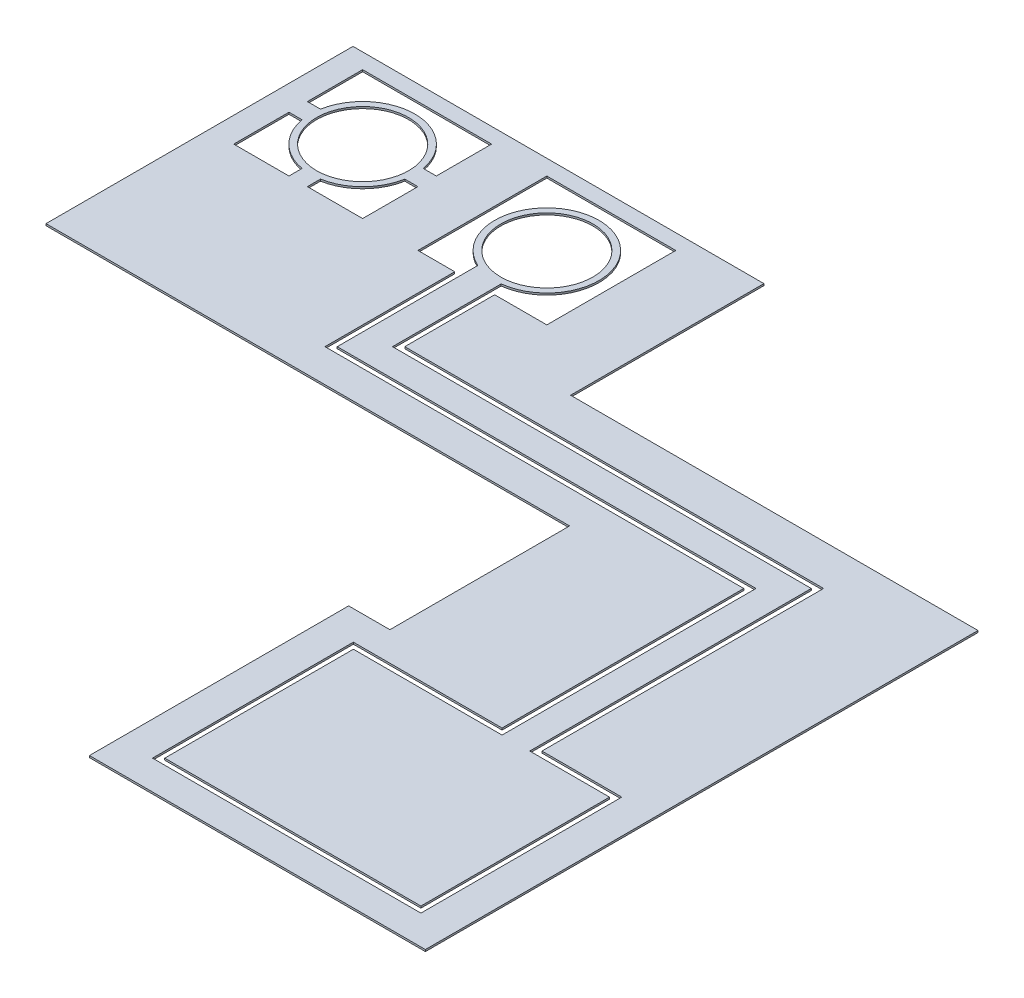
from build123d import *

# Parameters (mm, degrees)
SKETCH1_W               = 2.1
SKETCH1_H               = 2.1
BOSS_EXTRUDE1_DEPTH     = 0.03
CUT_EXTRUDE1_DEPTH      = 16.124307753
CUT_EXTRUDE1_DEPTH_BACK = 16.124307753
BOSS_EXTRUDE2_DEPTH     = 0.03
BOSS_EXTRUDE3_DEPTH     = 0.03
CUT_EXTRUDE2_DEPTH      = 16.124307753
CUT_EXTRUDE2_DEPTH_BACK = 16.124307753
SKETCH5_R               = 0.75


with BuildPart() as part:
    # Sketch1 → Boss-Extrude1 (new body)
    with BuildSketch(Plane(origin=(0, 0, 0), x_dir=(1, 0, 0), z_dir=(0, 1, 0))):
        Polygon((0, 0), (0, 5), (6.692, 5), (6.692, 1.851), (13.328, 1.851), (13.328, -7.149), (7.856, -7.149), (7.856, -2.927), (8.528, -2.927), (8.528, 0), align=None)
        with Locations((1.457, 3.7)):
            Rectangle(SKETCH1_W, SKETCH1_H, mode=Mode.SUBTRACT)
        with Locations((4.457, 3.7)):
            Rectangle(SKETCH1_W, SKETCH1_H, mode=Mode.SUBTRACT)
    extrude(amount=BOSS_EXTRUDE1_DEPTH)

    # Sketch2 → Cut-Extrude1 (cut, two sides: drawn at the far end of the back side and taken through both)
    with BuildSketch(Plane(origin=(0, 0.03, 0), x_dir=(1, 0, 0), z_dir=(0, 1, 0)).offset(-CUT_EXTRUDE1_DEPTH_BACK)):
        Polygon((4.107, 2.65), (4.107, 0.636), (10.928, 0.636), (10.928, -3.5), (8.506, -3.5), (8.506, -6.572), (12.678, -6.572), (12.678, -3.5), (11.378, -3.5), (11.378, 1.086), (4.557, 1.086), (4.557, 2.65), (4.657, 2.65), (4.657, 1.186), (11.478, 1.186), (11.478, -3.4), (12.778, -3.4), (12.778, -6.672), (8.406, -6.672), (8.406, -3.4), (10.828, -3.4), (10.828, 0.536), (4.007, 0.536), (4.007, 2.65), align=None)
    extrude(amount=CUT_EXTRUDE1_DEPTH + CUT_EXTRUDE1_DEPTH_BACK, mode=Mode.SUBTRACT)


with BuildPart() as cut_extrude1_piece_1:
    # of the separate pieces the step leaves, piece 1, a body of its own (cut_extrude1_pieces)
    add(part.part.solids().sort_by_distance((0, 0, 0))[0])

    # Sketch4 → Boss-Extrude3 (add)
    with BuildSketch(Plane(origin=(0, 0.03, 0), x_dir=(1, 0, 0), z_dir=(0, 1, 0))):
        with BuildLine():
            Line((1.307, 2.65), (1.607, 2.65))
            Line((1.607, 2.65), (1.607, 2.863339973))
            ThreePointArc((1.607, 2.863339973), (2.058040764, 3.098959236), (2.293660027, 3.55))
            Line((2.293660027, 3.55), (2.507, 3.55))
            Line((2.507, 3.55), (2.507, 3.85))
            Line((2.507, 3.85), (2.293660027, 3.85))
            ThreePointArc((2.293660027, 3.85), (1.457, 4.55), (0.620339973, 3.85))
            Line((0.620339973, 3.85), (0.407, 3.85))
            Line((0.407, 3.85), (0.407, 3.55))
            Line((0.407, 3.55), (0.620339973, 3.55))
            ThreePointArc((0.620339973, 3.55), (0.855959236, 3.098959236), (1.307, 2.863339973))
            Line((1.307, 2.863339973), (1.307, 2.65))
        make_face()
    extrude(amount=-BOSS_EXTRUDE3_DEPTH)


with BuildPart() as cut_extrude1_piece_2:
    # of the separate pieces the step leaves, piece 2, a body of its own (cut_extrude1_pieces)
    add(part.part.solids().sort_by_distance((4.107, 0, -2.65))[0])

    # Sketch3 → Boss-Extrude2 (add)
    with BuildSketch(Plane(origin=(0, 0.03, 0), x_dir=(1, 0, 0), z_dir=(0, 1, 0))):
        with BuildLine():
            Line((4.107, 2.65), (4.557, 2.65))
            Line((4.557, 2.65), (4.557, 2.855902849))
            ThreePointArc((4.557, 2.855902849), (4.58674043, 4.54004013), (4.107, 2.925403331))
            Line((4.107, 2.925403331), (4.107, 2.65))
        make_face()
    extrude(amount=-BOSS_EXTRUDE2_DEPTH)


with BuildPart() as cut_extrude2_tool:
    # Sketch5 → Cut-Extrude2 (new, two sides: drawn at the far end of the back side and taken through both)
    with BuildSketch(Plane(origin=(0, 0.03, 0), x_dir=(1, 0, 0), z_dir=(0, 1, 0)).offset(-CUT_EXTRUDE2_DEPTH_BACK)):
        with Locations(Location((1.457, 3.7, 0), (0, 0, 270))):
            Circle(SKETCH5_R)
        with Locations(Location((4.457, 3.7, 0), (0, 0, 270))):
            Circle(SKETCH5_R)
    extrude(amount=CUT_EXTRUDE2_DEPTH + CUT_EXTRUDE2_DEPTH_BACK)


with BuildPart() as cut_extrude1_piece_1_1:
    add(cut_extrude1_piece_1.part)

    # Cut-Extrude2: cut by cut_extrude2_tool
    add(cut_extrude2_tool.part, mode=Mode.SUBTRACT)


with BuildPart() as cut_extrude1_piece_2_1:
    add(cut_extrude1_piece_2.part)

    # Cut-Extrude2: cut by cut_extrude2_tool
    add(cut_extrude2_tool.part, mode=Mode.SUBTRACT)


solid = Compound([cut_extrude1_piece_1_1.part, cut_extrude1_piece_2_1.part])
